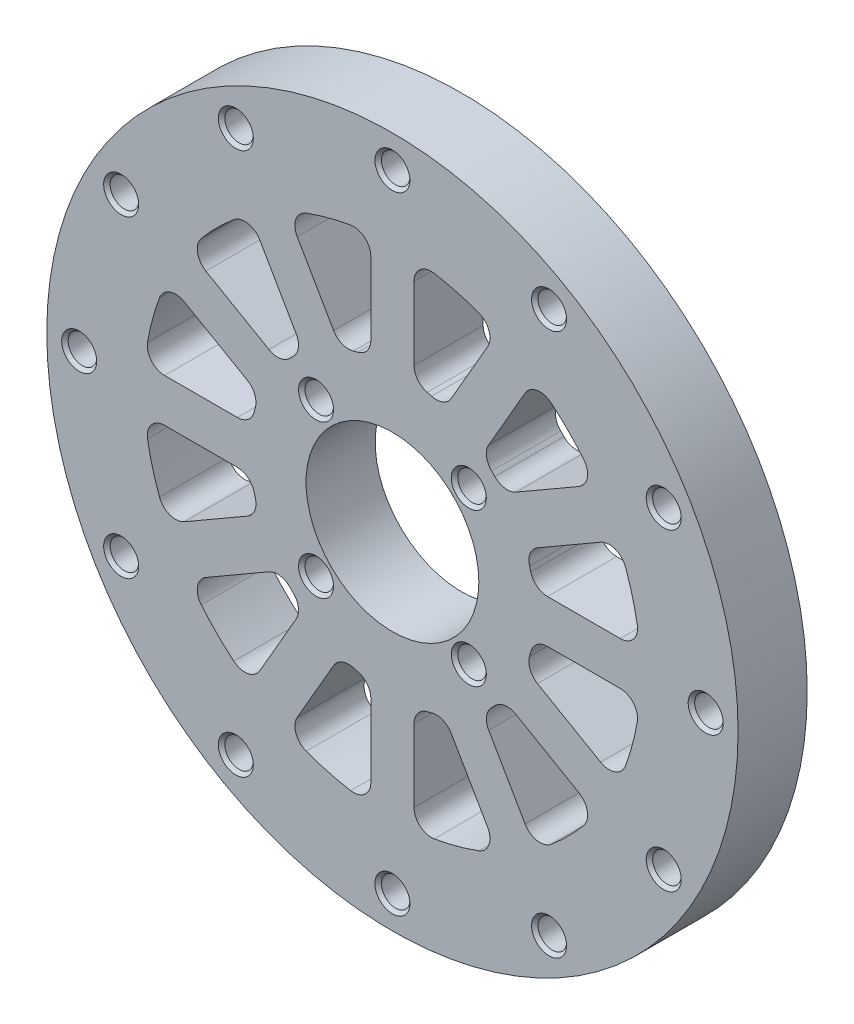
from build123d import *

# Parameters (mm, degrees)
SKETCH1_R                       = 40
SKETCH1_R_2                     = 10
BOSS_EXTRUDE1_DEPTH             = 4
M4X0_7_TAPPED_HOLE2_D           = 3.3
M4X0_7_TAPPED_HOLE2_CSINK_D     = 4.05
M4X0_7_TAPPED_HOLE2_CSINK_ANGLE = 90
M4X0_7_TAPPED_HOLE3_D           = 3.3
M4X0_7_TAPPED_HOLE3_CSINK_D     = 4.05
M4X0_7_TAPPED_HOLE3_CSINK_ANGLE = 90
CIRPATTERN1_COUNT               = 12
FILLET1_R                       = 2


with BuildPart() as part:
    # Sketch1 → Boss-Extrude1 (new, symmetric)
    with BuildSketch(Plane.XY):
        Circle(SKETCH1_R)
        Circle(SKETCH1_R_2, mode=Mode.SUBTRACT)
        with BuildLine():
            Line((-2.5, 28.641098093), (-2.5, 16.30950643))
            ThreePointArc((-2.5, 16.30950643), (-4.270514244, 15.937776134), (-5.989689706, 15.374446892))
            Line((-5.989689706, 15.374446892), (-12.155485537, 26.053918541))
            ThreePointArc((-12.155485537, 26.053918541), (-7.441047547, 27.770367506), (-2.5, 28.641098093))
        make_face(mode=Mode.SUBTRACT)
        with BuildLine():
            Line((2.5, 28.641098093), (2.5, 16.30950643))
            ThreePointArc((2.5, 16.30950643), (4.270514244, 15.937776134), (5.989689706, 15.374446892))
            Line((5.989689706, 15.374446892), (12.155485537, 26.053918541))
            ThreePointArc((12.155485537, 26.053918541), (7.441047547, 27.770367506), (2.5, 28.641098093))
        make_face(mode=Mode.SUBTRACT)
        with BuildLine():
            Line((16.485612556, 23.553918541), (10.319816725, 12.874446892))
            ThreePointArc((10.319816725, 12.874446892), (11.66726189, 11.66726189), (12.874446892, 10.319816725))
            Line((12.874446892, 10.319816725), (23.553918541, 16.485612556))
            ThreePointArc((23.553918541, 16.485612556), (20.329319959, 20.329319959), (16.485612556, 23.553918541))
        make_face(mode=Mode.SUBTRACT)
        with BuildLine():
            Line((26.053918541, 12.155485537), (15.374446892, 5.989689706))
            ThreePointArc((15.374446892, 5.989689706), (15.937776134, 4.270514244), (16.30950643, 2.5))
            Line((16.30950643, 2.5), (28.641098093, 2.5))
            ThreePointArc((28.641098093, 2.5), (27.770367506, 7.441047547), (26.053918541, 12.155485537))
        make_face(mode=Mode.SUBTRACT)
        with BuildLine():
            Line((28.641098093, -2.5), (16.30950643, -2.5))
            ThreePointArc((16.30950643, -2.5), (15.937776134, -4.270514244), (15.374446892, -5.989689706))
            Line((15.374446892, -5.989689706), (26.053918541, -12.155485537))
            ThreePointArc((26.053918541, -12.155485537), (27.770367506, -7.441047547), (28.641098093, -2.5))
        make_face(mode=Mode.SUBTRACT)
        with BuildLine():
            Line((23.553918541, -16.485612556), (12.874446892, -10.319816725))
            ThreePointArc((12.874446892, -10.319816725), (11.66726189, -11.66726189), (10.319816725, -12.874446892))
            Line((10.319816725, -12.874446892), (16.485612556, -23.553918541))
            ThreePointArc((16.485612556, -23.553918541), (20.329319959, -20.329319959), (23.553918541, -16.485612556))
        make_face(mode=Mode.SUBTRACT)
        with BuildLine():
            Line((12.155485537, -26.053918541), (5.989689706, -15.374446892))
            ThreePointArc((5.989689706, -15.374446892), (4.270514244, -15.937776134), (2.5, -16.30950643))
            Line((2.5, -16.30950643), (2.5, -28.641098093))
            ThreePointArc((2.5, -28.641098093), (7.441047547, -27.770367506), (12.155485537, -26.053918541))
        make_face(mode=Mode.SUBTRACT)
        with BuildLine():
            Line((-2.5, -28.641098093), (-2.5, -16.30950643))
            ThreePointArc((-2.5, -16.30950643), (-4.270514244, -15.937776134), (-5.989689706, -15.374446892))
            Line((-5.989689706, -15.374446892), (-12.155485537, -26.053918541))
            ThreePointArc((-12.155485537, -26.053918541), (-7.441047547, -27.770367506), (-2.5, -28.641098093))
        make_face(mode=Mode.SUBTRACT)
        with BuildLine():
            Line((-16.485612556, -23.553918541), (-10.319816725, -12.874446892))
            ThreePointArc((-10.319816725, -12.874446892), (-11.66726189, -11.66726189), (-12.874446892, -10.319816725))
            Line((-12.874446892, -10.319816725), (-23.553918541, -16.485612556))
            ThreePointArc((-23.553918541, -16.485612556), (-20.329319959, -20.329319959), (-16.485612556, -23.553918541))
        make_face(mode=Mode.SUBTRACT)
        with BuildLine():
            Line((-26.053918541, -12.155485537), (-15.374446892, -5.989689706))
            ThreePointArc((-15.374446892, -5.989689706), (-15.937776134, -4.270514244), (-16.30950643, -2.5))
            Line((-16.30950643, -2.5), (-28.641098093, -2.5))
            ThreePointArc((-28.641098093, -2.5), (-27.770367506, -7.441047547), (-26.053918541, -12.155485537))
        make_face(mode=Mode.SUBTRACT)
        with BuildLine():
            Line((-28.641098093, 2.5), (-16.30950643, 2.5))
            ThreePointArc((-16.30950643, 2.5), (-15.937776134, 4.270514244), (-15.374446892, 5.989689706))
            Line((-15.374446892, 5.989689706), (-26.053918541, 12.155485537))
            ThreePointArc((-26.053918541, 12.155485537), (-27.770367506, 7.441047547), (-28.641098093, 2.5))
        make_face(mode=Mode.SUBTRACT)
        with BuildLine():
            Line((-23.553918541, 16.485612556), (-12.874446892, 10.319816725))
            ThreePointArc((-12.874446892, 10.319816725), (-11.66726189, 11.66726189), (-10.319816725, 12.874446892))
            Line((-10.319816725, 12.874446892), (-16.485612556, 23.553918541))
            ThreePointArc((-16.485612556, 23.553918541), (-20.329319959, 20.329319959), (-23.553918541, 16.485612556))
        make_face(mode=Mode.SUBTRACT)
    extrude(amount=BOSS_EXTRUDE1_DEPTH, both=True)

    # M4x0.7 Tapped Hole2 (through all)
    with Locations(Plane.XY.offset(4)):
        with Locations((-8.838834765, 8.838834765), (-8.838834765, -8.838834765), (8.838834765, -8.838834765), (8.838834765, 8.838834765)):
            CounterSinkHole(M4X0_7_TAPPED_HOLE2_D / 2, M4X0_7_TAPPED_HOLE2_CSINK_D / 2, counter_sink_angle=M4X0_7_TAPPED_HOLE2_CSINK_ANGLE)

    # M4x0.7 Tapped Hole3 (through all)
    with Locations(Plane.XY.offset(4)):
        with Locations((0, 36.25)):
            m4x0_7_tapped_hole3 = CounterSinkHole(M4X0_7_TAPPED_HOLE3_D / 2, M4X0_7_TAPPED_HOLE3_CSINK_D / 2, counter_sink_angle=M4X0_7_TAPPED_HOLE3_CSINK_ANGLE)

    # CirPattern1: M4x0.7 Tapped Hole3 ×12 about axis
    cirpattern1_axis = Axis((0, 0, 0), (0, 0, 1))
    for i in range(1, CIRPATTERN1_COUNT):
        add(m4x0_7_tapped_hole3.rotate(cirpattern1_axis, i * 360 / CIRPATTERN1_COUNT), mode=Mode.SUBTRACT)

    # Fillet1
    fillet1_edges = [part.edges().sort_by_distance(p)[0] for p in [
        (28.641098093, 2.5, 0),
        (26.053918541, 12.155485537, 0),
        (15.374446892, 5.989689706, 0),
        (16.30950643, 2.5, 0),
        (16.485612556, -23.553918541, 0),
        (23.553918541, -16.485612556, 0),
        (12.874446892, -10.319816725, 0),
        (10.319816725, -12.874446892, 0),
        (-26.053918541, 12.155485537, 0),
        (-28.641098093, 2.5, 0),
        (-16.30950643, 2.5, 0),
        (2.5, -28.641098093, 0),
        (12.155485537, -26.053918541, 0),
        (5.989689706, -15.374446892, 0),
        (2.5, -16.30950643, 0),
        (-15.374446892, 5.989689706, 0),
        (-23.553918541, -16.485612556, 0),
        (-16.485612556, -23.553918541, 0),
        (-10.319816725, -12.874446892, 0),
        (-12.874446892, -10.319816725, 0),
        (-28.641098093, -2.5, 0),
        (-26.053918541, -12.155485537, 0),
        (-15.374446892, -5.989689706, 0),
        (-16.30950643, -2.5, 0),
        (26.053918541, -12.155485537, 0),
        (28.641098093, -2.5, 0),
        (16.30950643, -2.5, 0),
        (15.374446892, -5.989689706, 0),
        (12.155485537, 26.053918541, 0),
        (2.5, 28.641098093, 0),
        (2.5, 16.30950643, 0),
        (5.989689706, 15.374446892, 0),
        (-12.155485537, -26.053918541, 0),
        (-2.5, -28.641098093, 0),
        (-2.5, -16.30950643, 0),
        (-5.989689706, -15.374446892, 0),
        (-5.989689706, 15.374446892, 0),
        (-2.5, 16.30950643, 0),
        (-2.5, 28.641098093, 0),
        (-12.155485537, 26.053918541, 0),
        (-16.485612556, 23.553918541, 0),
        (-23.553918541, 16.485612556, 0),
        (-12.874446892, 10.319816725, 0),
        (-10.319816725, 12.874446892, 0),
        (23.553918541, 16.485612556, 0),
        (16.485612556, 23.553918541, 0),
        (10.319816725, 12.874446892, 0),
        (12.874446892, 10.319816725, 0),
    ]]
    fillet(fillet1_edges, radius=FILLET1_R)


solid = part.part
